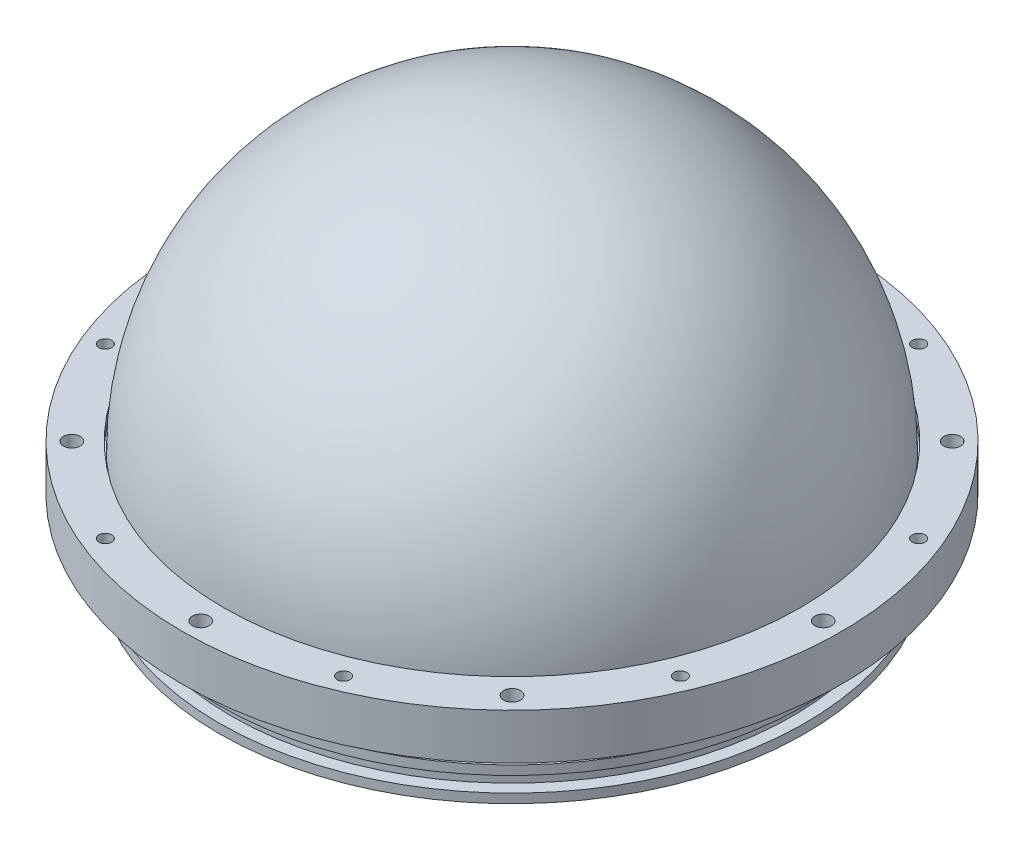
from build123d import *

# Parameters (mm, degrees)
F_5_5_5_5_DIAMETER_HOLE1_D = 5.5
M5X0_8_TAPPED_HOLE1_D      = 4.2


with BuildPart() as part:
    # Sketch1 → Revolve1 (revolve)
    with BuildSketch(Plane.XY, mode=Mode.PRIVATE) as revolve1_sk:
        Polygon((78.5, -17.5), (78.5, 2.5), (73.5, 2.5), (73.5, 6.5), (78.5, 6.5), (78.5, 14.5), (94.5, 14.5), (94.5, 17.5), (108, 17.5), (108, 2.5), (96, 2.5), (96, -1.5), (92, -1.5), (92, -6.5), (96, -6.5), (96, -9.5), (92, -9.5), (92, -14.5), (96, -14.5), (96, -17.5), align=None)
    revolve(revolve1_sk.sketch.rotate(Axis((0, 17.5, 0), (0, -1, 0)), 90), axis=Axis((0, 17.5, 0), (0, -1, 0)))

    # Ø5.5 (5.5) Diameter Hole1 (through all)
    with Locations(Plane(origin=(0, 17.5, 0), x_dir=(1, 0, 0), z_dir=(0, 1, 0))):
        with Locations((102, 0), (72.124891681, -72.124891681), (0, -102), (-72.124891681, -72.124891681), (-102, 0), (-72.124891681, 72.124891681), (0, 102), (72.124891681, 72.124891681)):
            Hole(F_5_5_5_5_DIAMETER_HOLE1_D / 2)

    # M5x0.8 Tapped Hole1 (through all)
    with Locations(Plane(origin=(0, 17.5, 0), x_dir=(1, 0, 0), z_dir=(0, 1, 0))):
        with Locations((94.235712316, 39.033710101), (94.235712316, -39.033710101), (39.033710101, -94.235712316), (-39.033710101, -94.235712316), (-94.235712316, -39.033710101), (-94.235712316, 39.033710101), (-39.033710101, 94.235712316), (39.033710101, 94.235712316)):
            Hole(M5X0_8_TAPPED_HOLE1_D / 2)


with BuildPart() as body_2:
    # Sketch6 → Revolve2 (revolve)
    with BuildSketch(Plane.XY):
        with BuildLine():
            Line((87.65, 14.5), (94, 14.5))
            ThreePointArc((94, 14.5), (66.468037432, 80.968037432), (0, 108.5))
            Line((0, 108.5), (0, 102.15))
            ThreePointArc((0, 102.15), (61.977909371, 76.477909371), (87.65, 14.5))
        make_face()
    revolve(axis=Axis((0, 108.5, 0), (0, -1, 0)))


solid = Compound([part.part, body_2.part])
